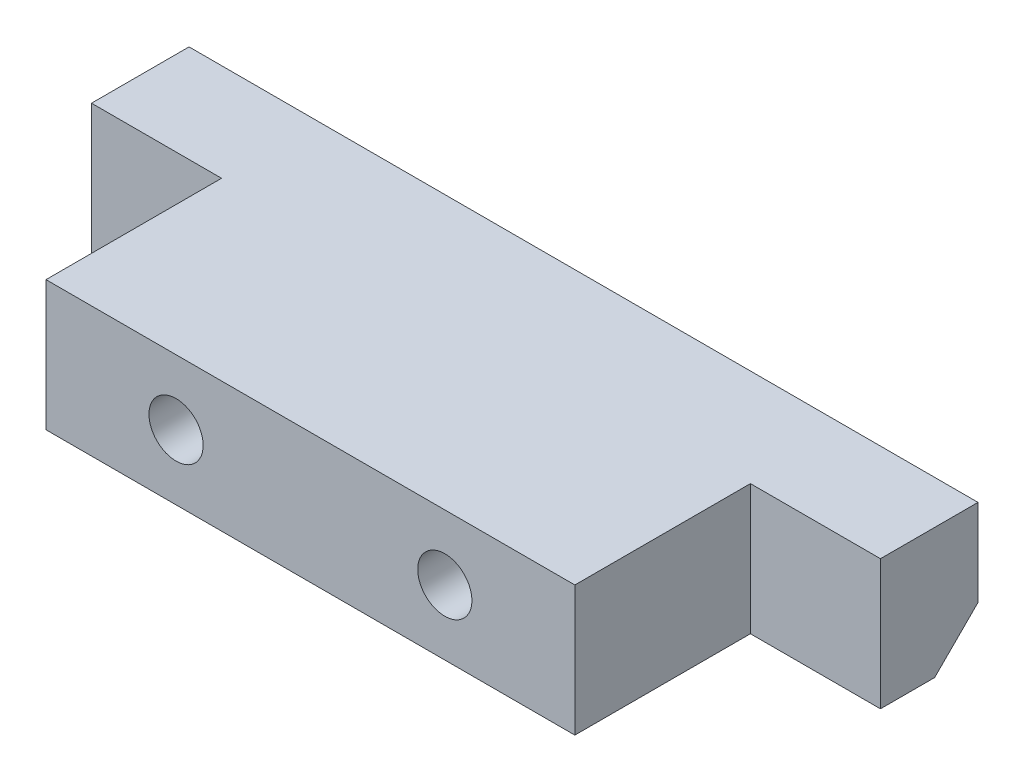
from build123d import *

# Parameters (mm, degrees)
ESBO_O1_W                     = 24.4
ESBO_O1_H                     = 6
RESSALTO_EXTRUS_O1_DEPTH      = 8.1
ESBO_O3_W                     = 36.4
ESBO_O3_H                     = 6
RESSALTO_EXTRUS_O2_DEPTH      = 4.5
CHANFRO1_SIZE                 = 2
FURO_ROSCADO_DE_M3X0_51_D     = 2.5
FURO_ROSCADO_DE_M3X0_51_DEPTH = 8.5
FURO_ROSCADO_DE_M3X0_51_TIP   = 0.751075774


with BuildPart() as part:
    # Esboço1 → Ressalto-extrusão1 (new body)
    with BuildSketch(Plane.XY):
        with Locations((0, 3)):
            Rectangle(ESBO_O1_W, ESBO_O1_H)
    extrude(amount=RESSALTO_EXTRUS_O1_DEPTH)

    # Esboço3 → Ressalto-extrusão2 (add)
    with BuildSketch(Plane(origin=(0, 0, 0), x_dir=(-1, 0, 0), z_dir=(0, 0, -1))):
        with Locations((0, 3)):
            Rectangle(ESBO_O3_W, ESBO_O3_H)
    extrude(amount=RESSALTO_EXTRUS_O2_DEPTH)

    # Chanfro1
    chanfro1_edges = [part.edges().sort_by_distance(p)[0] for p in [
        (0, 0, -4.5),
    ]]
    chamfer(chanfro1_edges, length=CHANFRO1_SIZE)

    # Furo roscado de M3x0.51
    with Locations(Plane.XY.offset(8.1)):
        with Locations((-6.2, 3), (6.2, 3)):
            Hole(FURO_ROSCADO_DE_M3X0_51_D / 2, depth=FURO_ROSCADO_DE_M3X0_51_DEPTH)
            with Locations((0, 0, -(FURO_ROSCADO_DE_M3X0_51_DEPTH + FURO_ROSCADO_DE_M3X0_51_TIP / 2))):  # 118° drill point
                Cone(0, FURO_ROSCADO_DE_M3X0_51_D / 2, FURO_ROSCADO_DE_M3X0_51_TIP, mode=Mode.SUBTRACT)


solid = part.part
